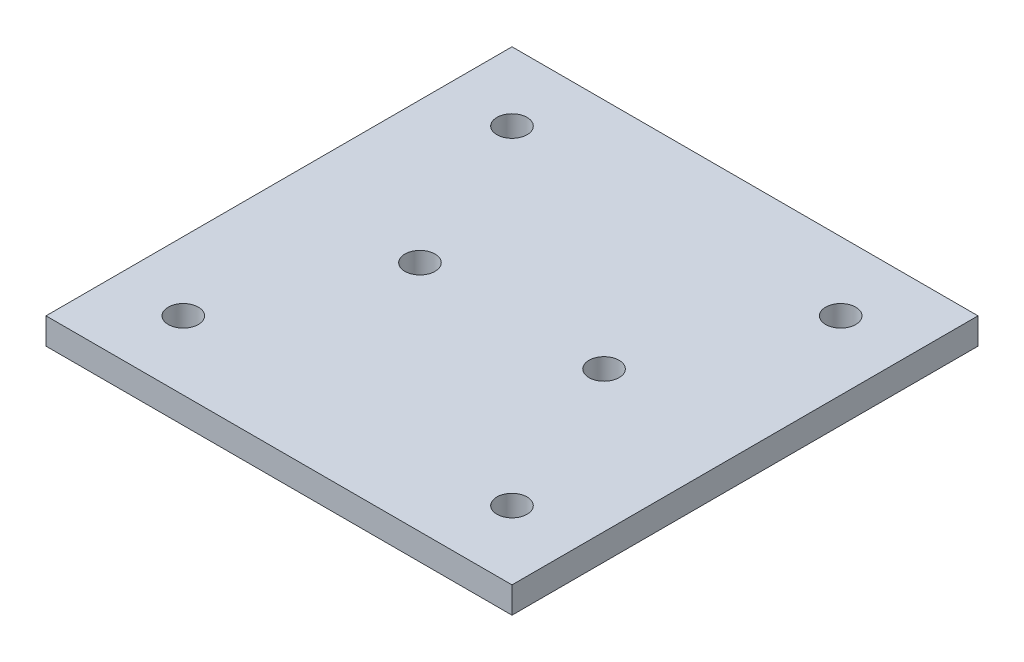
from build123d import *

# Parameters (mm, degrees)
SKETCH1_W           = 35.443085122
SKETCH1_H           = 35.443085122
SKETCH1_R           = 1.146225587
BOSS_EXTRUDE1_DEPTH = 2


with BuildPart() as part:
    # Sketch1 → Boss-Extrude1 (new body)
    with BuildSketch(Plane(origin=(0, 0, 0), x_dir=(1, 0, 0), z_dir=(0, 1, 0))):
        Rectangle(SKETCH1_W, SKETCH1_H)
        with Locations(Location((-12.5, 12.5, 0), (0, 0, 270))):
            Circle(SKETCH1_R, mode=Mode.SUBTRACT)
        with Locations(Location((12.5, 12.5, 0), (0, 0, 90))):
            Circle(SKETCH1_R, mode=Mode.SUBTRACT)
        with Locations(Location((12.5, -12.5, 0), (0, 0, 270))):
            Circle(SKETCH1_R, mode=Mode.SUBTRACT)
        with Locations(Location((-12.5, -12.5, 0), (0, 0, 90))):
            Circle(SKETCH1_R, mode=Mode.SUBTRACT)
        with Locations(Location((-7, 0, 0), (0, 0, 270))):
            Circle(SKETCH1_R, mode=Mode.SUBTRACT)
        with Locations(Location((7, 0, 0), (0, 0, 90))):
            Circle(SKETCH1_R, mode=Mode.SUBTRACT)
    extrude(amount=BOSS_EXTRUDE1_DEPTH)


solid = part.part
